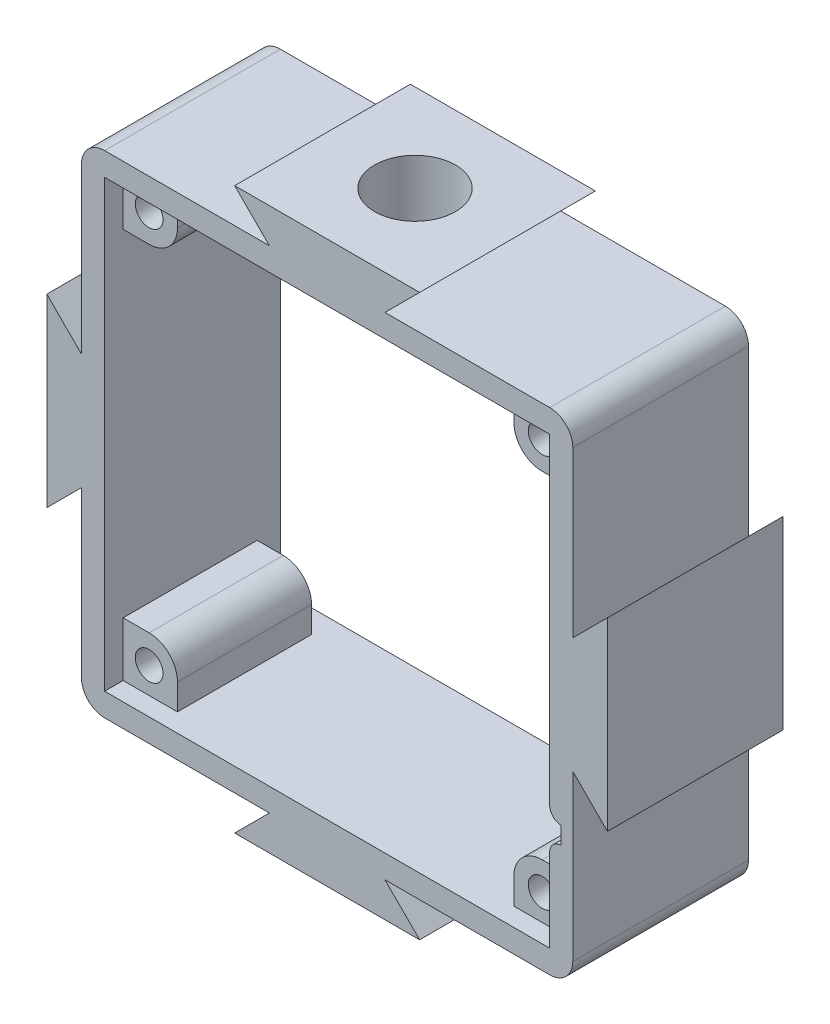
from build123d import *

# Parameters (mm, degrees)
SKETCH1_W           = 42.5
SKETCH1_H           = 42.5
SKETCH1_W_2         = 38.5
SKETCH1_H_2         = 38.5
BOSS_EXTRUDE2_DEPTH = 15.2
SKETCH2_R           = 1.2
BOSS_EXTRUDE4_DEPTH = 11.6
BOSS_EXTRUDE5_DEPTH = 15.2
CIRPATTERN1_COUNT   = 4
CUT_EXTRUDE2_DEPTH  = 4
CUT_EXTRUDE3_REACH  = 58.315
SKETCH4_R           = 3.5
FILLET1_R           = 2


with BuildPart() as part:
    # Sketch1 → Boss-Extrude2 (new body)
    with BuildSketch(Plane.XY):
        Rectangle(SKETCH1_W, SKETCH1_H)
        Rectangle(SKETCH1_W_2, SKETCH1_H_2, mode=Mode.SUBTRACT)
    extrude(amount=-BOSS_EXTRUDE2_DEPTH)

    # Sketch2 → Boss-Extrude4 (add)
    # profile 1 of 4: a face of its own
    with BuildSketch(Plane(origin=(0, 0, -1.6), x_dir=(-1, 0, 0), z_dir=(0, 0, -1))):
        with BuildLine():
            Line((17, -14.55), (19.25, -14.55))
            Line((19.25, -14.55), (19.25, -19.25))
            Line((19.25, -19.25), (14.55, -19.25))
            Line((14.55, -19.25), (14.55, -17))
            ThreePointArc((14.55, -17), (15.267588386, -15.267588386), (17, -14.55))
        make_face()
        with Locations(Location((17, -17, 0), (0, 0, 90))):
            Circle(SKETCH2_R, mode=Mode.SUBTRACT)
    # profile 2 of 4: a face of its own
    with BuildSketch(Plane(origin=(0, 0, -1.6), x_dir=(-1, 0, 0), z_dir=(0, 0, -1))):
        with BuildLine():
            Line((19.25, 14.55), (19.25, 19.25))
            Line((19.25, 19.25), (14.55, 19.25))
            Line((14.55, 19.25), (14.55, 17))
            ThreePointArc((14.55, 17), (15.267588386, 15.267588386), (17, 14.55))
            Line((17, 14.55), (19.25, 14.55))
        make_face()
        with Locations(Location((17, 17, 0), (0, 0, 180))):
            Circle(SKETCH2_R, mode=Mode.SUBTRACT)
    # profile 3 of 4: a face of its own
    with BuildSketch(Plane(origin=(0, 0, -1.6), x_dir=(-1, 0, 0), z_dir=(0, 0, -1))):
        with BuildLine():
            Line((-19.25, -14.55), (-19.25, -19.25))
            Line((-19.25, -19.25), (-14.55, -19.25))
            Line((-14.55, -19.25), (-14.55, -17))
            ThreePointArc((-14.55, -17), (-15.267588386, -15.267588386), (-17, -14.55))
            Line((-17, -14.55), (-19.25, -14.55))
        make_face()
        with Locations(Location((-17, -17, 0), (0, 0, 180))):
            Circle(SKETCH2_R, mode=Mode.SUBTRACT)
    # profile 4 of 4: a face of its own
    with BuildSketch(Plane(origin=(0, 0, -1.6), x_dir=(-1, 0, 0), z_dir=(0, 0, -1))):
        with BuildLine():
            Line((-17, 14.55), (-19.25, 14.55))
            Line((-19.25, 14.55), (-19.25, 19.25))
            Line((-19.25, 19.25), (-14.55, 19.25))
            Line((-14.55, 19.25), (-14.55, 17))
            ThreePointArc((-14.55, 17), (-15.267588386, 15.267588386), (-17, 14.55))
        make_face()
        with Locations(Location((-17, 17, 0), (0, 0, 90))):
            Circle(SKETCH2_R, mode=Mode.SUBTRACT)
    extrude(amount=BOSS_EXTRUDE4_DEPTH)

    # Sketch5 → Boss-Extrude5 (add)
    with BuildSketch(Plane.XY):
        Polygon((-21.25, 5), (-21.25, -5), (-24.25, -8), (-24.25, 8), align=None)
    boss_extrude5 = extrude(amount=-BOSS_EXTRUDE5_DEPTH)

    # CirPattern1: Boss-Extrude5 ×4 about axis
    cirpattern1_axis = Axis((0, 0, 0), (0, 0, 1))
    for i in range(1, CIRPATTERN1_COUNT):
        add(boss_extrude5.rotate(cirpattern1_axis, i * 360 / CIRPATTERN1_COUNT))

    # Sketch3 → Cut-Extrude2 (cut)
    with BuildSketch(Plane.XY):
        with BuildLine():
            Line((20.25, -11.05), (20.25, -9.55))
            ThreePointArc((20.25, -9.55), (19.542893219, -9.257106781), (19.25, -8.55))
            Line((19.25, -8.55), (19.25, -12.05))
            ThreePointArc((19.25, -12.05), (19.542893219, -11.342893219), (20.25, -11.05))
        make_face()
    extrude(amount=-CUT_EXTRUDE2_DEPTH, mode=Mode.SUBTRACT)

    # Sketch4 → Cut-Extrude3 (cut, up to next)
    with BuildSketch(Plane(origin=(0, 24.25, 0), x_dir=(1, 0, 0), z_dir=(0, 1, 0)), mode=Mode.PRIVATE) as cut_extrude3_sk1:
        with Locations(Location((0, 7.6, 0), (0, 0, 180))):
            Circle(SKETCH4_R)
    cut_extrude3_tool1 = extrude(cut_extrude3_sk1.sketch, amount=-CUT_EXTRUDE3_REACH, mode=Mode.PRIVATE) & part.part
    add(cut_extrude3_tool1.solids().sort_by_distance((0, 24.25, -7.6))[0], mode=Mode.SUBTRACT)

    # Fillet1
    fillet1_edges = [part.edges().sort_by_distance(p)[0] for p in [
        (-21.25, -21.25, -7.6),
        (-21.25, 21.25, -7.6),
        (21.25, 21.25, -7.6),
        (21.25, -21.25, -7.6),
    ]]
    fillet(fillet1_edges, radius=FILLET1_R)


solid = part.part
